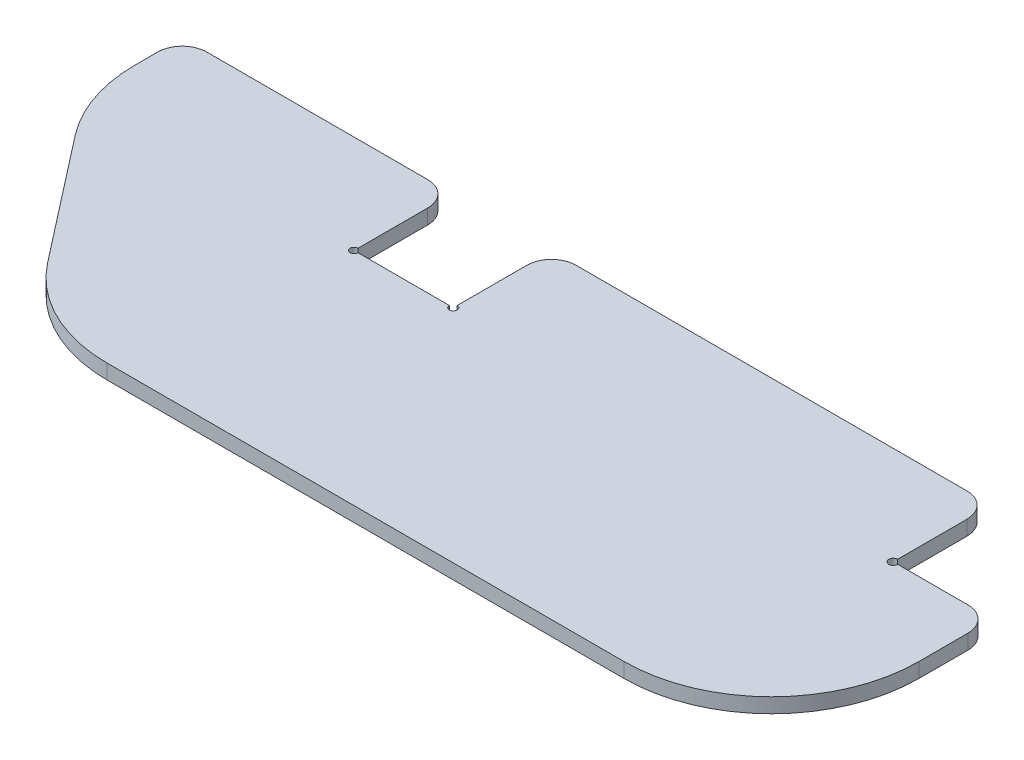
from build123d import *

# Parameters (mm, degrees)
SKETCH1_W           = 150
SKETCH1_H           = 45
BOSS_EXTRUDE1_DEPTH = 3
FILLET1_R           = 30
SKETCH2_W           = 89.6
SKETCH2_H           = 20
BOSS_EXTRUDE2_DEPTH = 3
FILLET2_R           = 30
SKETCH3_R           = 0.8
SKETCH3_R_2         = 0.899402105
CUT_EXTRUDE1_DEPTH  = 118.962917902
FILLET3_R           = 5


with BuildPart() as part:
    # Sketch1 → Boss-Extrude1 (new body)
    with BuildSketch(Plane(origin=(0, 0, 0), x_dir=(1, 0, 0), z_dir=(0, 1, 0))):
        Rectangle(SKETCH1_W, SKETCH1_H)
    extrude(amount=BOSS_EXTRUDE1_DEPTH)

    # Fillet1
    fillet1_edges = [part.edges().sort_by_distance(p)[0] for p in [
        (75, 1.5, 22.5),
    ]]
    fillet(fillet1_edges, radius=FILLET1_R)

    # Sketch2 → Boss-Extrude2 (add)
    with BuildSketch(Plane(origin=(0, 3, 0), x_dir=(1, 0, 0), z_dir=(0, 1, 0))):
        Polygon((-75, 22.5), (-55, 22.5), (-55, 42.5), (-110, 42.5), (-110, 22.5), align=None)
        Polygon((-75, -22.5), (-75, 22.5), (-110, 22.5), align=None)
        with Locations((10, 32.5)):
            Rectangle(SKETCH2_W, SKETCH2_H)
    extrude(amount=-BOSS_EXTRUDE2_DEPTH)

    # Fillet2
    fillet2_edges = [part.edges().sort_by_distance(p)[0] for p in [
        (-110, 1.5, -22.5),
        (-75, 1.5, 22.5),
    ]]
    fillet(fillet2_edges, radius=FILLET2_R)

    # Sketch3 → Cut-Extrude1 (cut, through all)
    with BuildSketch(Plane(origin=(0, 3, 0), x_dir=(1, 0, 0), z_dir=(0, 1, 0))):
        with Locations((-55, 22.5)):
            Circle(SKETCH3_R)
        with Locations((-34.8, 22.5)):
            Circle(SKETCH3_R)
        with Locations((54.8, 22.5)):
            Circle(SKETCH3_R_2)
    extrude(amount=-CUT_EXTRUDE1_DEPTH, mode=Mode.SUBTRACT)

    # Fillet3
    fillet3_edges = [part.edges().sort_by_distance(p)[0] for p in [
        (-55, 1.5, -42.5),
        (-110, 1.5, -42.5),
        (-34.8, 1.5, -42.5),
        (54.8, 1.5, -42.5),
        (75, 1.5, -22.5),
    ]]
    fillet(fillet3_edges, radius=FILLET3_R)


solid = part.part
